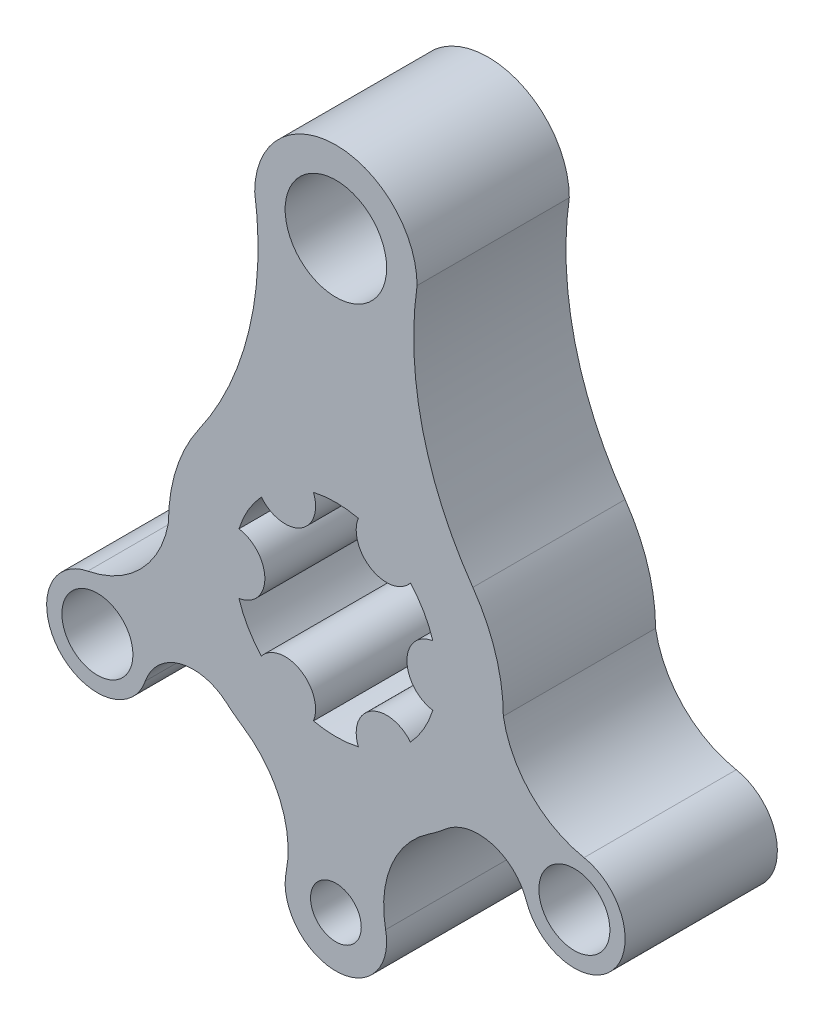
from build123d import *

# Parameters (mm, degrees)
SKETCH1_R           = 7
SKETCH1_R_2         = 5
SKETCH1_R_3         = 10
BOSS_EXTRUDE1_DEPTH = 15


with BuildPart() as part:
    # Sketch1 → Boss-Extrude1 (new, symmetric)
    with BuildSketch(Plane.XY):
        with BuildLine():
            ThreePointArc((-18.313197236, -27.452264151), (-10.929939867, -36.447383635), (-9.804034884, -48.03))
            ThreePointArc((-9.804034884, -48.03), (0, -60), (9.804034884, -48.03))
            ThreePointArc((9.804034884, -48.03), (10.929939867, -36.447383635), (18.313197236, -27.452264151))
            ThreePointArc((18.313197236, -27.452264151), (19.978209416, -26.265398313), (21.566520754, -24.9776937))
            ThreePointArc((21.566520754, -24.9776937), (30.697148757, -22.889346352), (37.550915036, -29.273345896))
            ThreePointArc((37.550915036, -29.273345896), (54.555971575, -32.550365911), (48.899852708, -16.182130593))
            ThreePointArc((48.899852708, -16.182130593), (38.43354311, -10.563553249), (33, 0))
            ThreePointArc((33, 0), (31.461859707, 9.957478785), (26.990825227, 18.986715186))
            ThreePointArc((26.990825227, 18.986715186), (17.541357446, 39.155919937), (15.576262231, 61.342124263))
            ThreePointArc((15.576262231, 61.342124263), (15.761817989, 63.174110312), (16, 65))
            ThreePointArc((16, 65), (0, 81), (-16, 65))
            ThreePointArc((-16, 65), (-15.761817989, 63.174110312), (-15.576262231, 61.342124263))
            ThreePointArc((-15.576262231, 61.342124263), (-17.541357446, 39.155919937), (-26.990825227, 18.986715186))
            ThreePointArc((-26.990825227, 18.986715186), (-31.461859707, 9.957478785), (-33, 0))
            ThreePointArc((-33, 0), (-38.43354311, -10.563553249), (-48.899852708, -16.182130593))
            ThreePointArc((-48.899852708, -16.182130593), (-54.555971575, -32.550365911), (-37.550915036, -29.273345896))
            ThreePointArc((-37.550915036, -29.273345896), (-30.697148757, -22.889346352), (-21.566520754, -24.9776937))
            ThreePointArc((-21.566520754, -24.9776937), (-19.978209416, -26.265398313), (-18.313197236, -27.452264151))
        make_face()
        with Locations((-47, -26)):
            Circle(SKETCH1_R, mode=Mode.SUBTRACT)
        with Locations((0, -50)):
            Circle(SKETCH1_R_2, mode=Mode.SUBTRACT)
        with BuildLine():
            ThreePointArc((19.1, -5.93211598), (17.320508076, -10), (14.687363137, -13.575027222))
            ThreePointArc((14.687363137, -13.575027222), (7, -12.124355653), (4.412636863, -19.507143202))
            ThreePointArc((4.412636863, -19.507143202), (0, -20), (-4.412636863, -19.507143202))
            ThreePointArc((-4.412636863, -19.507143202), (-7, -12.124355653), (-14.687363137, -13.575027222))
            ThreePointArc((-14.687363137, -13.575027222), (-17.320508076, -10), (-19.1, -5.93211598))
            ThreePointArc((-19.1, -5.93211598), (-14, 0), (-19.1, 5.93211598))
            ThreePointArc((-19.1, 5.93211598), (-17.320508076, 10), (-14.687363137, 13.575027222))
            ThreePointArc((-14.687363137, 13.575027222), (-7, 12.124355653), (-4.412636863, 19.507143202))
            ThreePointArc((-4.412636863, 19.507143202), (0, 20), (4.412636863, 19.507143202))
            ThreePointArc((4.412636863, 19.507143202), (7, 12.124355653), (14.687363137, 13.575027222))
            ThreePointArc((14.687363137, 13.575027222), (17.320508076, 10), (19.1, 5.93211598))
            ThreePointArc((19.1, 5.93211598), (14, 0), (19.1, -5.93211598))
        make_face(mode=Mode.SUBTRACT)
        with Locations((47, -26)):
            Circle(SKETCH1_R, mode=Mode.SUBTRACT)
        with Locations((0, 65)):
            Circle(SKETCH1_R_3, mode=Mode.SUBTRACT)
    extrude(amount=BOSS_EXTRUDE1_DEPTH, both=True)


solid = part.part
